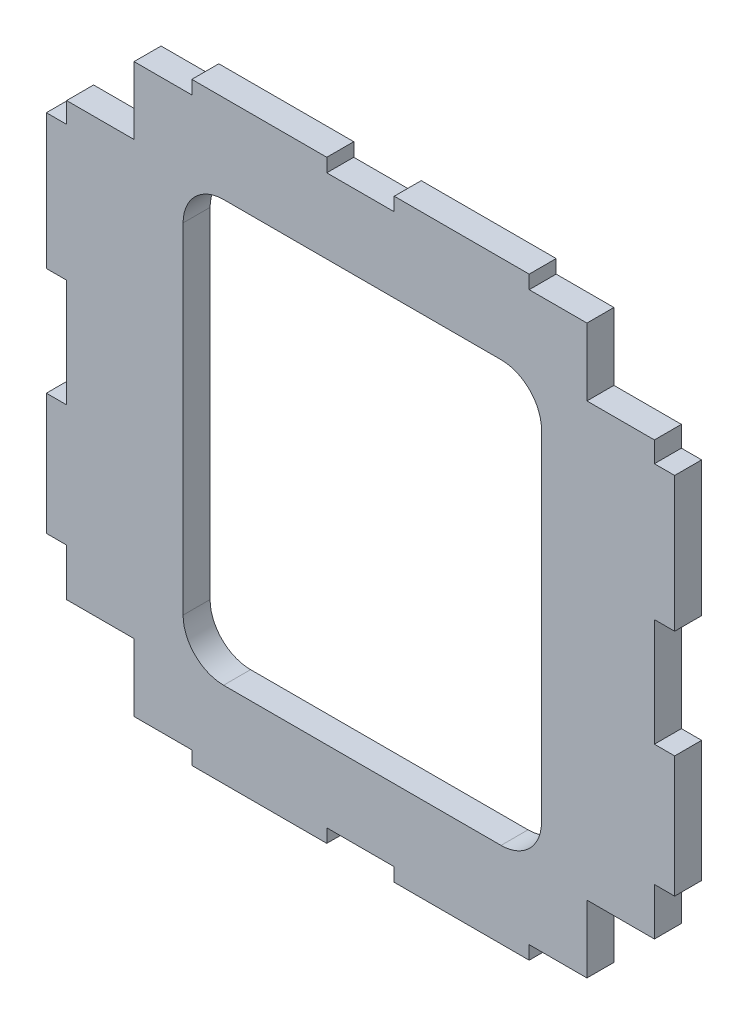
from build123d import *

# Parameters (mm, degrees)
EXTRUDE_1_DEPTH = 2


with BuildPart() as part:
    # Model → 凸台-拉伸1 (new body)
    with BuildSketch(Plane.XY):
        Polygon((28.387820918, 51.014416594), (32.667820918, 51.014416594), (32.667820918, 52.0147723), (42.667820918, 52.0147723), (42.667820918, 51.014416594), (47.667820918, 51.014416594), (47.667820918, 52.0147723), (57.667820918, 52.0147723), (57.667820918, 51.014416594), (61.947820918, 51.014416594), (61.947820918, 46.014416594), (66.947820918, 46.014416594), (66.947820918, 44.484416594), (68.447820918, 44.484416594), (68.447820918, 34.484416594), (66.947820918, 34.484416594), (66.947820918, 26.484416594), (68.447820918, 26.484416594), (68.447820918, 17.484416594), (66.947820918, 17.484416594), (66.947820918, 13.980947232), (61.947820918, 13.980947232), (61.947820918, 8.980947232), (57.667820918, 8.980947232), (57.667820918, 7.980591527), (47.667820918, 7.980591527), (47.667820918, 8.980947232), (42.667820918, 8.980947232), (42.667820918, 7.980591527), (32.667820918, 7.980591527), (32.667820918, 8.980947232), (28.387820918, 8.980947232), (28.387820918, 13.980947232), (23.387820918, 13.980947232), (23.387820918, 17.484416594), (21.887820918, 17.484416594), (21.887820918, 26.484416594), (23.387820918, 26.484416594), (23.387820918, 34.484416594), (21.887820918, 34.484416594), (21.887820918, 44.484416594), (23.387820918, 44.484416594), (23.387820918, 46.014416594), (28.387820918, 46.014416594), align=None)
        with BuildLine():
            Line((55.581295365, 45.477977184), (35.021295365, 45.477977184))
            ThreePointArc((35.021295365, 45.477977184), (32.899975022, 44.599297528), (32.021295365, 42.477977184))
            Line((32.021295365, 42.477977184), (32.021295365, 17.307977184))
            ThreePointArc((32.021295365, 17.307977184), (32.899975022, 15.186656841), (35.021295365, 14.307977184))
            Line((35.021295365, 14.307977184), (55.581295365, 14.307977184))
            ThreePointArc((55.581295365, 14.307977184), (57.702615709, 15.186656841), (58.581295365, 17.307977184))
            Line((58.581295365, 17.307977184), (58.581295365, 42.477977184))
            ThreePointArc((58.581295365, 42.477977184), (57.702615709, 44.599297528), (55.581295365, 45.477977184))
        make_face(mode=Mode.SUBTRACT)
    extrude(amount=EXTRUDE_1_DEPTH)


solid = part.part
